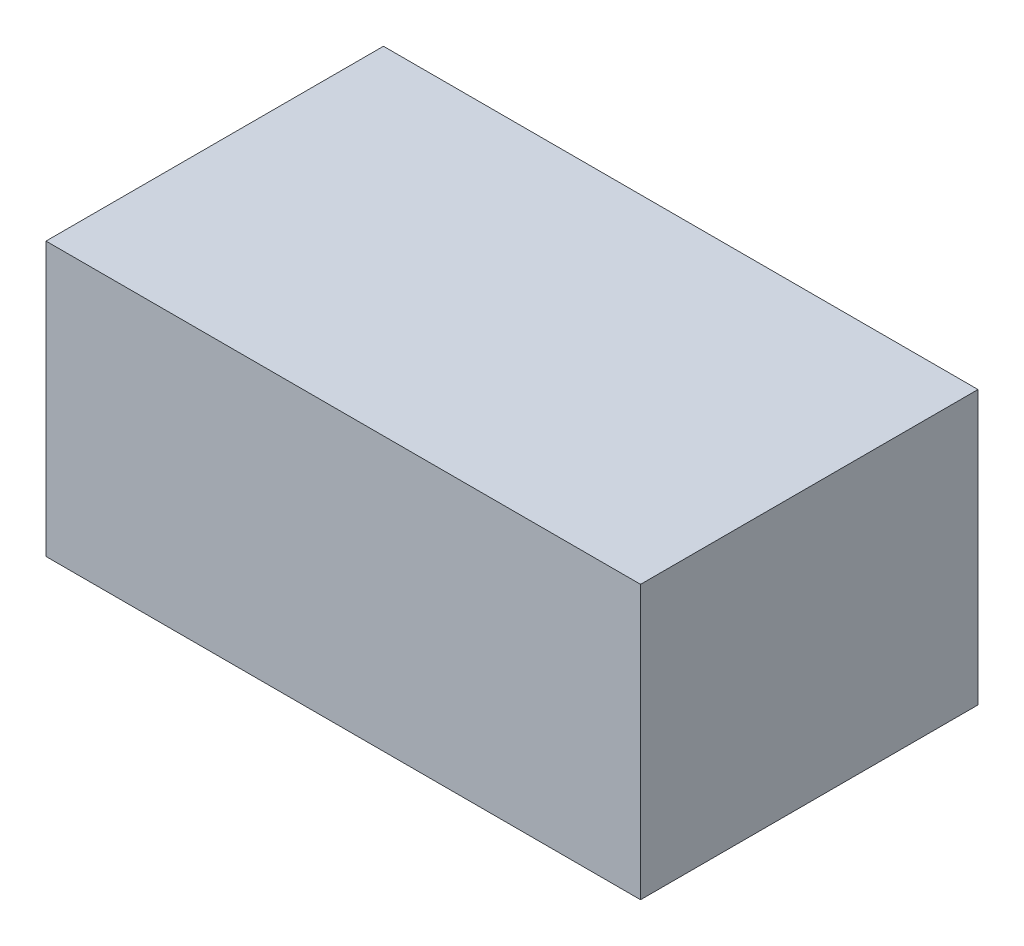
from build123d import *

# Parameters (mm, degrees)
SKETCH1_W           = 37
SKETCH1_H           = 21
BOSS_EXTRUDE1_DEPTH = 17
SKETCH4_W           = 33.25
SKETCH4_H           = 13
CUT_EXTRUDE1_DEPTH  = 19


with BuildPart() as part:
    # Sketch1 → Boss-Extrude1 (new body)
    with BuildSketch(Plane(origin=(0, 0, 0), x_dir=(1, 0, 0), z_dir=(0, 1, 0))):
        with Locations((-5.322580645, -31.725806452)):
            Rectangle(SKETCH1_W, SKETCH1_H)
    extrude(amount=BOSS_EXTRUDE1_DEPTH)

    # Sketch4 → Cut-Extrude1 (cut)
    with BuildSketch(Plane(origin=(0, 0, 21.225806452), x_dir=(-1, 0, 0), z_dir=(0, 0, -1))):
        with Locations((5.322580645, 8.5)):
            Rectangle(SKETCH4_W, SKETCH4_H)
    extrude(amount=-CUT_EXTRUDE1_DEPTH, mode=Mode.SUBTRACT)


solid = part.part
